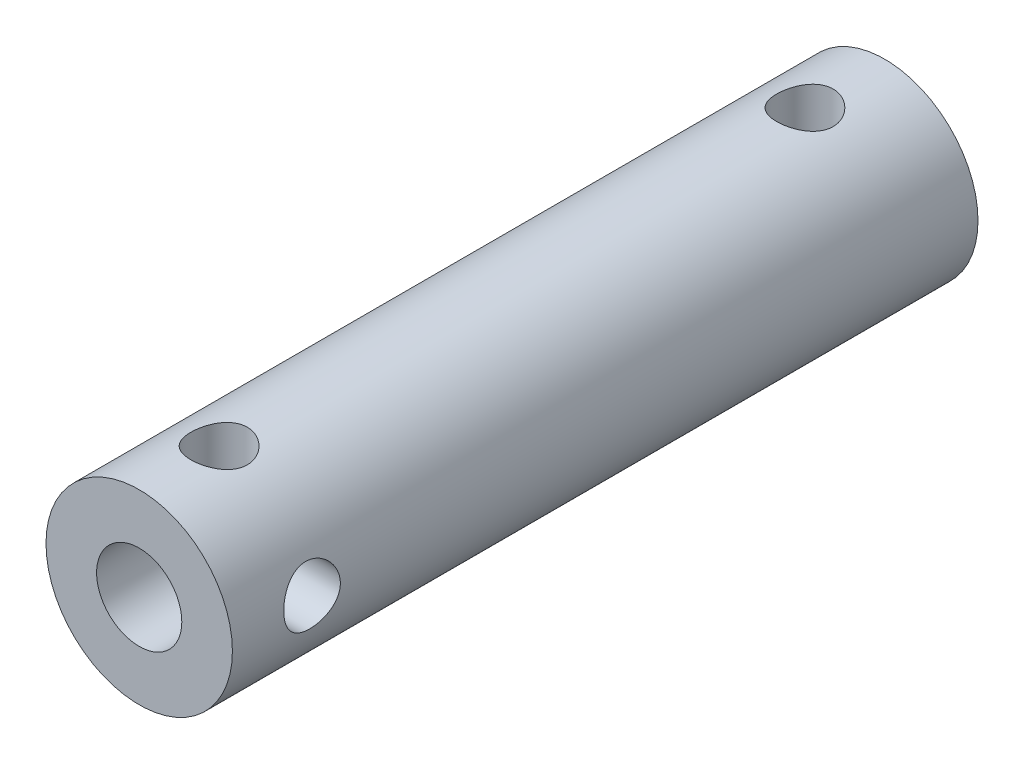
from build123d import *

# Parameters (mm, degrees)
SKETCH1_R               = 11.1125
SKETCH1_R_2             = 5.08
BOSS_EXTRUDE1_DEPTH     = 88.9
CUT_EXTRUDE1_DEPTH      = 91.278376772
CUT_EXTRUDE1_DEPTH_BACK = 91.278376772
SKETCH2_R               = 3.3655
CUT_EXTRUDE2_DEPTH      = 91.278376895
CUT_EXTRUDE2_DEPTH_BACK = 91.278376895
SKETCH4_R               = 3.3655


with BuildPart() as part:
    # Sketch1 → Boss-Extrude1 (new body)
    with BuildSketch(Plane.XY):
        Circle(SKETCH1_R)
        Circle(SKETCH1_R_2, mode=Mode.SUBTRACT)
    extrude(amount=BOSS_EXTRUDE1_DEPTH)

    # Sketch2 → Cut-Extrude1 (cut, two sides: drawn at the far end of the back side and taken through both)
    with BuildSketch(Plane(origin=(0, 0, 0), x_dir=(1, 0, 0), z_dir=(0, 1, 0)).offset(-CUT_EXTRUDE1_DEPTH_BACK)):
        with Locations(Location((0, -79.375, 0), (0, 0, 270))):
            Circle(SKETCH2_R)
        with Locations(Location((0, -9.525, 0), (0, 0, 270))):
            Circle(SKETCH2_R)
    extrude(amount=CUT_EXTRUDE1_DEPTH + CUT_EXTRUDE1_DEPTH_BACK, mode=Mode.SUBTRACT)

    # Sketch4 → Cut-Extrude2 (cut, two sides: drawn at the far end of the back side and taken through both)
    with BuildSketch(Plane(origin=(0, 0, 0), x_dir=(0, 0, -1), z_dir=(1, 0, 0)).offset(-CUT_EXTRUDE2_DEPTH_BACK)):
        with Locations((-79.375, 0.73538363)):
            Circle(SKETCH4_R)
    extrude(amount=CUT_EXTRUDE2_DEPTH + CUT_EXTRUDE2_DEPTH_BACK, mode=Mode.SUBTRACT)


solid = part.part
